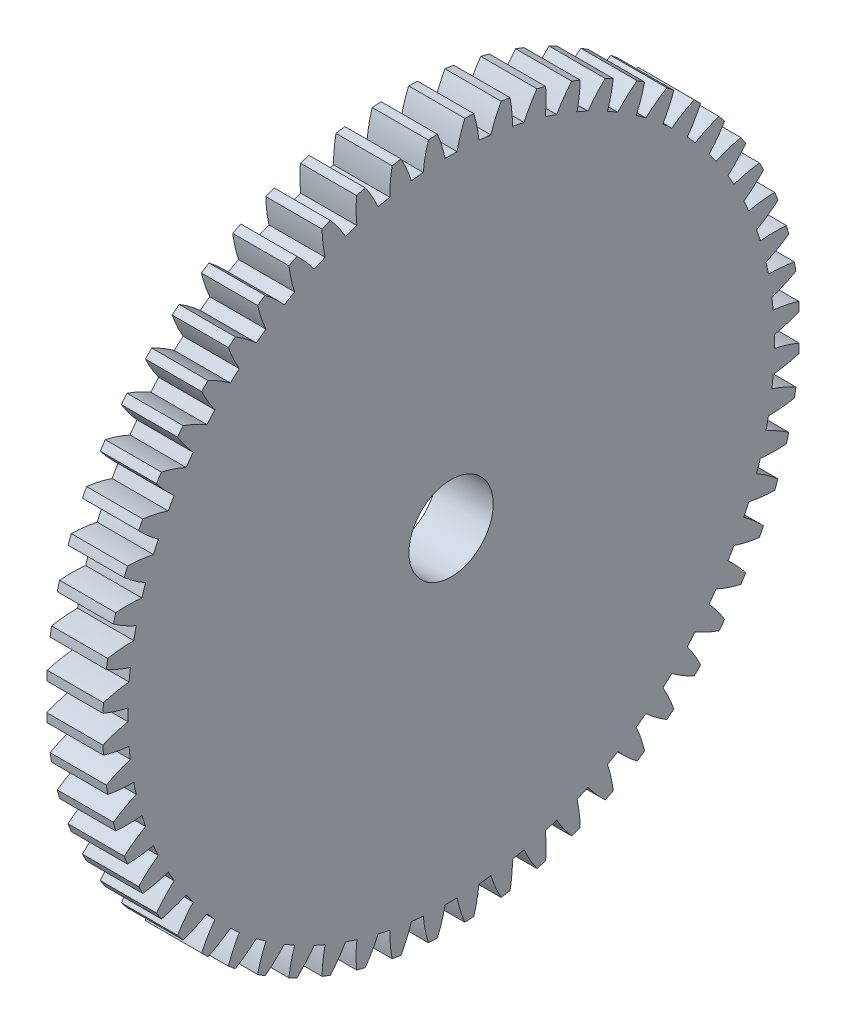
from build123d import *

# Parameters (mm, degrees)
BASPROSKE_W     = 6.35
BASPROSKE_H     = 39.37
TOOTHCUT_DEPTH  = 57.038525141
TEETHCUTS_COUNT = 60
TEETHCUTS_ANGLE = 354
BORSKE_R        = 4.7625
BORE_DEPTH      = 50.8000508


with BuildPart() as part:
    # BasProSke → Base-Revolve (revolve)
    with BuildSketch(Plane(origin=(0, 0, 0), x_dir=(1, 0, 0), z_dir=(0, 1, 0)), mode=Mode.PRIVATE) as base_revolve_sk:
        with Locations((3.175, 19.685)):
            Rectangle(BASPROSKE_W, BASPROSKE_H)
    revolve(base_revolve_sk.sketch.rotate(Axis((-10, 0, 0), (1, 0, 0)), 180), axis=Axis((-10, 0, 0), (1, 0, 0)))

    # TooCutSke → ToothCut (cut, through all)
    with BuildSketch(Plane(origin=(0, 0, 0), x_dir=(0, 0, -1), z_dir=(1, 0, 0))):
        with BuildLine():
            ThreePointArc((0.674018167, 36.51898047), (0, 36.5252), (-0.674018167, 36.51898047))
            ThreePointArc((-0.674018167, 36.51898047), (-1.047934425, 37.963458687), (-1.561312288, 39.364449))
            ThreePointArc((-1.561312288, 39.364449), (0, 39.3954), (1.561312288, 39.364449))
            ThreePointArc((1.561312288, 39.364449), (1.047934425, 37.963458687), (0.674018167, 36.51898047))
        make_face()
    toothcut = extrude(amount=TOOTHCUT_DEPTH, mode=Mode.SUBTRACT)

    # TeethCuts: ToothCut ×60 about axis
    teethcuts_axis = Axis((-10, 0, 0), (1, 0, 0))
    for i in range(1, TEETHCUTS_COUNT):
        add(toothcut.rotate(teethcuts_axis, i * TEETHCUTS_ANGLE / (TEETHCUTS_COUNT - 1)), mode=Mode.SUBTRACT)

    # BorSke → Bore (cut, symmetric)
    with BuildSketch(Plane(origin=(0, 0, 0), x_dir=(0, 0, -1), z_dir=(1, 0, 0))):
        with Locations(Location((0, 0, 0), (0, 0, 180))):
            Circle(BORSKE_R)
    extrude(amount=BORE_DEPTH, both=True, mode=Mode.SUBTRACT)


solid = part.part
